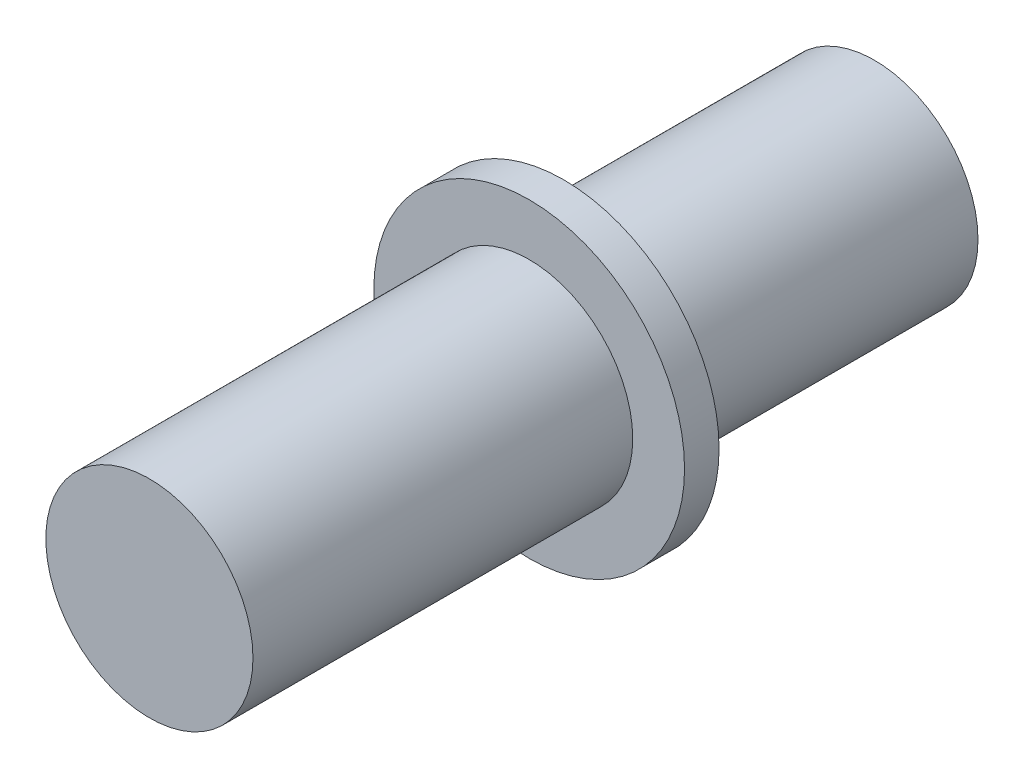
from build123d import *

# Parameters (mm, degrees)
SKETCH1_R           = 6
BOSS_EXTRUDE1_DEPTH = 42
BOSS_EXTRUDE2_START = -24
SKETCH2_R           = 9
BOSS_EXTRUDE2_DEPTH = 2


with BuildPart() as part:
    # Sketch1 → Boss-Extrude1 (new body)
    with BuildSketch(Plane.XY):
        Circle(SKETCH1_R)
    extrude(amount=BOSS_EXTRUDE1_DEPTH)

    # Sketch2 → Boss-Extrude2 (add)
    with BuildSketch(Plane.XY.offset(42).offset(BOSS_EXTRUDE2_START)):
        Circle(SKETCH2_R)
    extrude(amount=BOSS_EXTRUDE2_DEPTH)


solid = part.part
